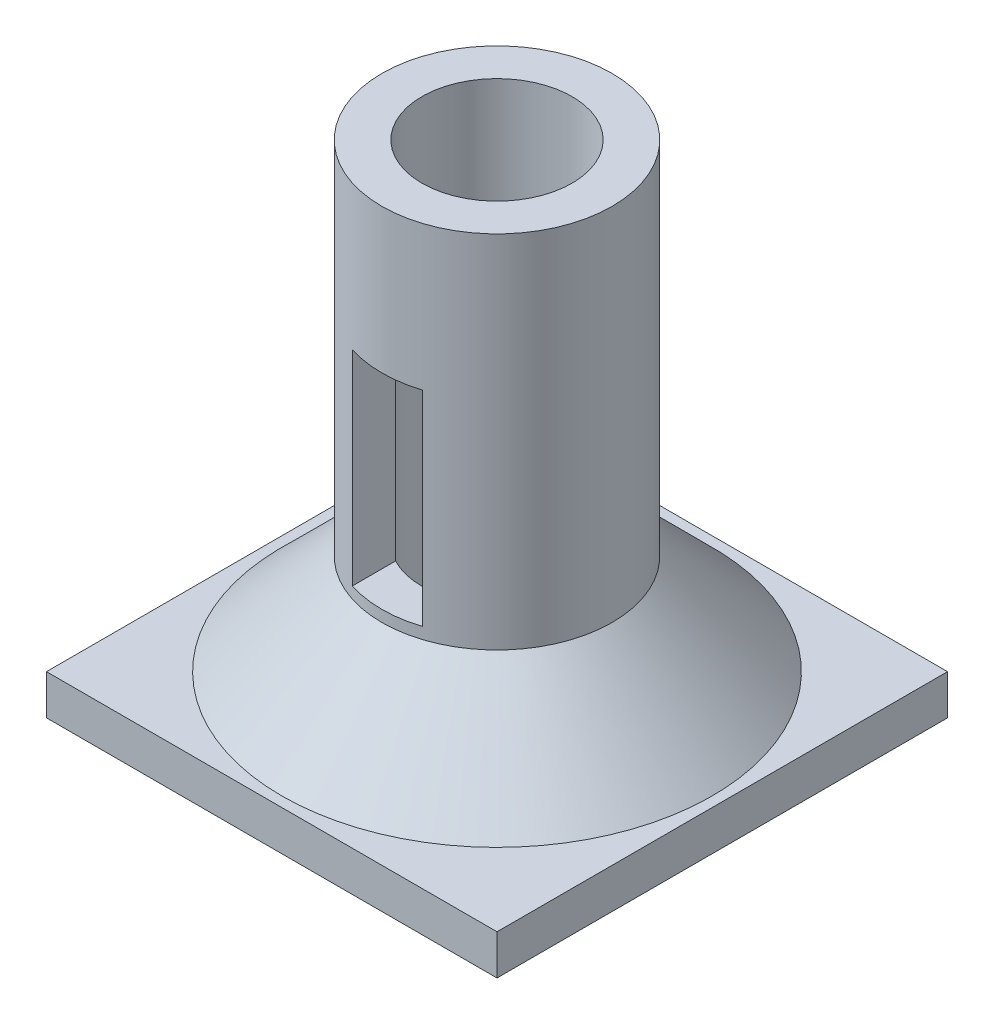
from build123d import *

# Parameters (mm, degrees)
SKETCH2_W           = 45
SKETCH2_H           = 45
BOSS_EXTRUDE1_DEPTH = 4
SKETCH2_3_R         = 11.5
SKETCH2_3_R_2       = 7.5
BOSS_EXTRUDE2_DEPTH = 46
CHAMFER1_SIZE       = 10
SKETCH3_W           = 7
SKETCH3_H           = 20.450898806
CUT_EXTRUDE1_DEPTH  = 19


with BuildPart() as part:
    # Sketch2 → Boss-Extrude1 (new body)
    with BuildSketch(Plane(origin=(0, 0, 0), x_dir=(1, 0, 0), z_dir=(0, 1, 0))):
        Rectangle(SKETCH2_W, SKETCH2_H)
    extrude(amount=-BOSS_EXTRUDE1_DEPTH)

    # Sketch2<3> → Boss-Extrude2 (add)
    with BuildSketch(Plane(origin=(0, 0, 0), x_dir=(1, 0, 0), z_dir=(0, 1, 0))):
        Circle(SKETCH2_3_R)
        Circle(SKETCH2_3_R_2, mode=Mode.SUBTRACT)
    extrude(amount=BOSS_EXTRUDE2_DEPTH)

    # Chamfer1
    chamfer1_edges = [part.edges().sort_by_distance(p)[0] for p in [
        (-11.5, 0, 0),
    ]]
    chamfer(chamfer1_edges, length=CHAMFER1_SIZE)

    # Sketch3 → Cut-Extrude1 (cut)
    with BuildSketch(Plane.XY):
        with Locations((0, 21.362604589)):
            Rectangle(SKETCH3_W, SKETCH3_H)
    extrude(amount=CUT_EXTRUDE1_DEPTH, mode=Mode.SUBTRACT)


solid = part.part
